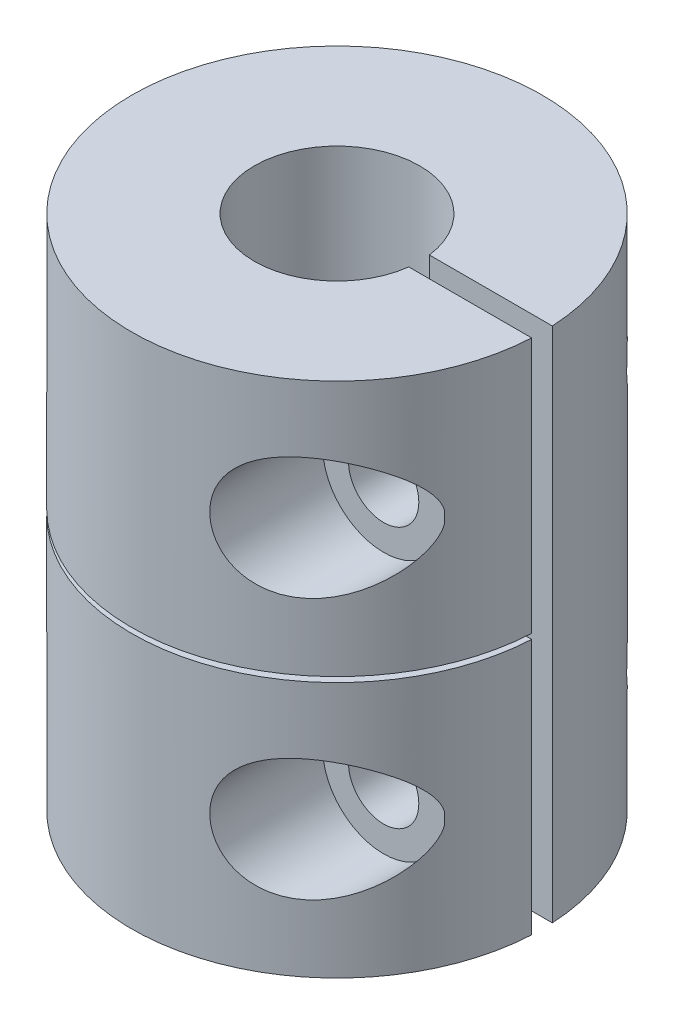
from build123d import *

# Parameters (mm, degrees)
SKETCH1_R                      = 9.925
BOSS_EXTRUDE1_DEPTH            = 12.5
CUT_EXTRUDE5_DEPTH             = 0.125
CUT_EXTRUDE1_REACH             = 30.671
SKETCH3_R                      = 4
SKETCH4_R                      = 2.5
CUT_EXTRUDE2_DEPTH             = 19.878608927
CUT_EXTRUDE6_DEPTH             = 19.795245409
CUT_EXTRUDE6_DEPTH_BACK        = 19.795245409
CBORE_FOR_M3_SHCS1_D           = 3.4
CBORE_FOR_M3_SHCS1_DEPTH       = 9.425
CBORE_FOR_M3_SHCS1_CBORE_D     = 5.9
CBORE_FOR_M3_SHCS1_CBORE_DEPTH = 6
M3X0_5_TAPPED_HOLE1_D          = 2.5


with BuildPart() as part:
    # Sketch1 → Boss-Extrude1 (new, symmetric)
    with BuildSketch(Plane(origin=(0, 0, 0), x_dir=(1, 0, 0), z_dir=(0, 1, 0))):
        with Locations(Location((0, 0, 0), (0, 0, 270))):
            Circle(SKETCH1_R)
    extrude(amount=BOSS_EXTRUDE1_DEPTH, both=True)

    # Sketch10 → Cut-Extrude5 (cut, symmetric)
    with BuildSketch(Plane(origin=(0, 0, 0), x_dir=(1, 0, 0), z_dir=(0, 1, 0))):
        with BuildLine():
            Line((0, -0.5), (0, 0))
            Line((0, 0), (-0.288675135, 0.5))
            Line((-0.288675135, 0.5), (-4.9625, 8.595302133))
            ThreePointArc((-4.9625, 8.595302133), (-5.177499554, -8.467533488), (9.91239754, -0.5))
            Line((9.91239754, -0.5), (0, -0.5))
        make_face()
    extrude(amount=CUT_EXTRUDE5_DEPTH, both=True, mode=Mode.SUBTRACT)

    # Cut-Extrude1: up to this face of the body (flat: up to its plane)
    cut_extrude1_end = Plane(part.part.faces().sort_by_distance((-1.523889636, -0.125, 2.421634097))[0])
    # Sketch3 → Cut-Extrude1 (cut, up to the picked face)
    with BuildSketch(Plane(origin=(0, 12.5, 0), x_dir=(1, 0, 0), z_dir=(0, 1, 0)), mode=Mode.PRIVATE) as cut_extrude1_sk1:
        with Locations(Location((0, 0, 0), (0, 0, 270))):
            Circle(SKETCH3_R)
    cut_extrude1_tool1 = split(extrude(cut_extrude1_sk1.sketch, amount=-CUT_EXTRUDE1_REACH, mode=Mode.PRIVATE), bisect_by=cut_extrude1_end, keep=Keep.BOTH, mode=Mode.PRIVATE)
    add(cut_extrude1_tool1.solids().sort_by(Axis((0, 12.5, 0), (0, -1, 0)))[0], mode=Mode.SUBTRACT)

    # Sketch4 → Cut-Extrude2 (cut, through all)
    with BuildSketch(Plane(origin=(0, -0.125, 0), x_dir=(1, 0, 0), z_dir=(0, 1, 0))):
        with Locations(Location((0, 0, 0), (0, 0, 270))):
            Circle(SKETCH4_R)
    extrude(amount=-CUT_EXTRUDE2_DEPTH, mode=Mode.SUBTRACT)

    # Sketch10<4> → Cut-Extrude6 (cut, two sides: drawn at the far end of the back side and taken through both)
    with BuildSketch(Plane(origin=(0, 0, 0), x_dir=(1, 0, 0), z_dir=(0, 1, 0)).offset(-CUT_EXTRUDE6_DEPTH_BACK)):
        with BuildLine():
            Line((-0.288675135, 0.5), (0, 0))
            Line((0, 0), (0, -0.5))
            Line((0, -0.5), (9.91239754, -0.5))
            ThreePointArc((9.91239754, -0.5), (9.921848885, -0.250079398), (9.925, 0))
            ThreePointArc((9.925, 0), (9.921848885, 0.250079398), (9.91239754, 0.5))
            Line((9.91239754, 0.5), (0, 0.5))
            Line((0, 0.5), (-0.288675135, 0.5))
        make_face()
    extrude(amount=CUT_EXTRUDE6_DEPTH + CUT_EXTRUDE6_DEPTH_BACK, mode=Mode.SUBTRACT)

    # CBORE for M3 SHCS1
    with Locations(Plane.XY.offset(9.925)):
        with Locations((6.180943642, -6.3125), (6.180943642, 6.3125)):
            CounterBoreHole(CBORE_FOR_M3_SHCS1_D / 2, CBORE_FOR_M3_SHCS1_CBORE_D / 2, CBORE_FOR_M3_SHCS1_CBORE_DEPTH, depth=CBORE_FOR_M3_SHCS1_DEPTH)

    # M3x0.5 Tapped Hole1 (through all)
    with Locations(Plane.XY.offset(-0.5)):
        with Locations((6.180943642, 6.3125), (6.180943642, -6.3125)):
            Hole(M3X0_5_TAPPED_HOLE1_D / 2)


solid = part.part
